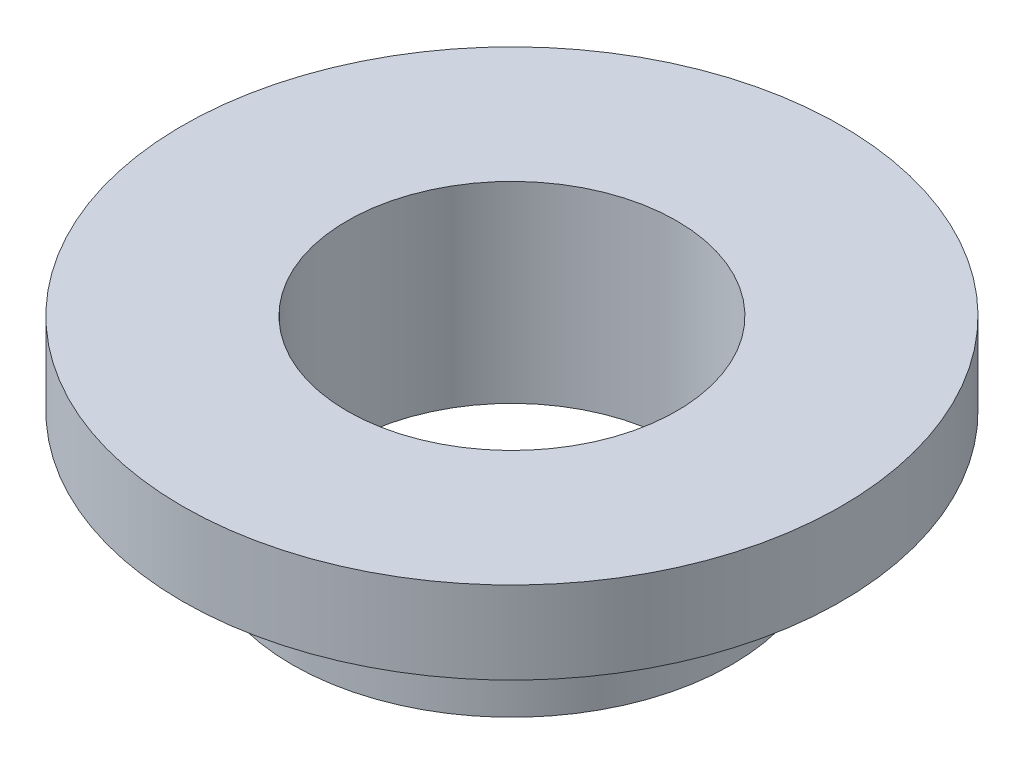
from build123d import *

# Parameters (mm, degrees)
SKETCH_1_R      = 8
SKETCH_1_R_2    = 6
EXTRUDE_1_DEPTH = 4
SKETCH_2_R      = 12
SKETCH_2_R_2    = 6
EXTRUDE_2_DEPTH = 3


with BuildPart() as part:
    # Эскиз1 → Вытянуть1 (new body)
    with BuildSketch(Plane(origin=(0, 0, 0), x_dir=(1, 0, 0), z_dir=(0, 1, 0))):
        with Locations(Location((0, 0, 0), (0, 0, 270))):
            Circle(SKETCH_1_R)
        with Locations(Location((0, 0, 0), (0, 0, 270))):
            Circle(SKETCH_1_R_2, mode=Mode.SUBTRACT)
    extrude(amount=EXTRUDE_1_DEPTH)

    # Эскиз2 → Вытянуть2 (add)
    with BuildSketch(Plane(origin=(0, 4, 0), x_dir=(-1, 0, 0), z_dir=(0, 1, 0))):
        with Locations(Location((0, 0, 0), (0, 0, 90))):
            Circle(SKETCH_2_R)
        with Locations(Location((0, 0, 0), (0, 0, 90))):
            Circle(SKETCH_2_R_2, mode=Mode.SUBTRACT)
    extrude(amount=EXTRUDE_2_DEPTH)


solid = part.part
